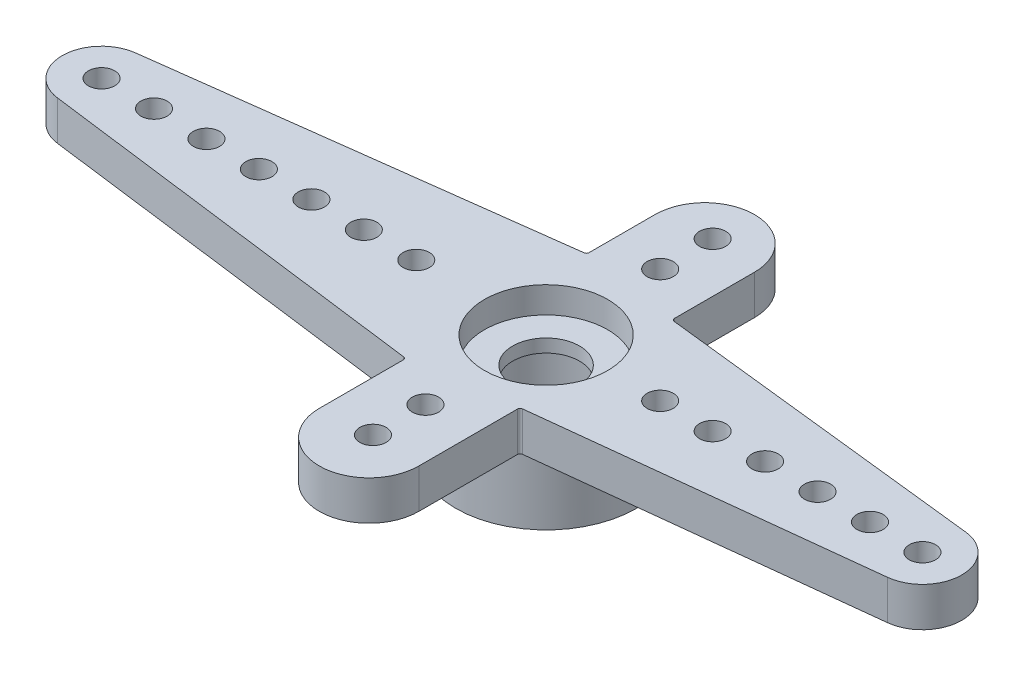
from build123d import *

# Parameters (mm, degrees)
IZIM1_R                     = 2.35
IZIM1_R_2                   = 0.5
Y_KSEKLIK_EKSTR_ZYON1_DEPTH = 1.5
IZIM1_3_R                   = 2.35
IZIM1_3_R_2                 = 1.275
Y_KSEKLIK_EKSTR_ZYON2_DEPTH = 0.5
IZIM2_R                     = 3.45
IZIM2_R_2                   = 2.3
Y_KSEKLIK_EKSTR_ZYON3_DEPTH = 2.5
RADYUS1_R                   = 0.1


with BuildPart() as part:
    # Çizim1 → Yükseklik-Ekstrüzyon1 (new body)
    with BuildSketch(Plane(origin=(0, 0, 0), x_dir=(1, 0, 0), z_dir=(0, 1, 0))):
        with BuildLine():
            Line((1.9, 2.9), (1.9, 6.05))
            ThreePointArc((1.9, 6.05), (0, 7.95), (-1.9, 6.05))
            Line((-1.9, 6.05), (-1.9, 3.45))
            Line((-1.9, 3.45), (-17.141537347, 1.487720889))
            ThreePointArc((-17.141537347, 1.487720889), (-18.45, 0), (-17.141537347, -1.487720889))
            Line((-17.141537347, -1.487720889), (-1.9, -3.45))
            Line((-1.9, -3.45), (-1.9, -6.75))
            ThreePointArc((-1.9, -6.75), (0, -8.65), (1.9, -6.75))
            Line((1.9, -6.75), (1.9, -2.9))
            Line((1.9, -2.9), (14.516515169, -1.490728915))
            ThreePointArc((14.516515169, -1.490728915), (15.85, 0), (14.516515169, 1.490728915))
            Line((14.516515169, 1.490728915), (1.9, 2.9))
        make_face()
        with Locations(Location((0, 0, 0), (0, 0, 270))):
            Circle(IZIM1_R, mode=Mode.SUBTRACT)
        with Locations(Location((-16.95, 0, 0), (0, 0, 270))):
            Circle(IZIM1_R_2, mode=Mode.SUBTRACT)
        with Locations(Location((-14.95, 0, 0), (0, 0, 270))):
            Circle(IZIM1_R_2, mode=Mode.SUBTRACT)
        with Locations(Location((-12.95, 0, 0), (0, 0, 270))):
            Circle(IZIM1_R_2, mode=Mode.SUBTRACT)
        with Locations(Location((-10.95, 0, 0), (0, 0, 270))):
            Circle(IZIM1_R_2, mode=Mode.SUBTRACT)
        with Locations(Location((-8.95, 0, 0), (0, 0, 270))):
            Circle(IZIM1_R_2, mode=Mode.SUBTRACT)
        with Locations(Location((-6.95, 0, 0), (0, 0, 270))):
            Circle(IZIM1_R_2, mode=Mode.SUBTRACT)
        with Locations(Location((-4.95, 0, 0), (0, 0, 270))):
            Circle(IZIM1_R_2, mode=Mode.SUBTRACT)
        with Locations(Location((14.35, 0, 0), (0, 0, 270))):
            Circle(IZIM1_R_2, mode=Mode.SUBTRACT)
        with Locations(Location((12.35, 0, 0), (0, 0, 270))):
            Circle(IZIM1_R_2, mode=Mode.SUBTRACT)
        with Locations(Location((10.35, 0, 0), (0, 0, 270))):
            Circle(IZIM1_R_2, mode=Mode.SUBTRACT)
        with Locations(Location((8.35, 0, 0), (0, 0, 270))):
            Circle(IZIM1_R_2, mode=Mode.SUBTRACT)
        with Locations(Location((6.35, 0, 0), (0, 0, 270))):
            Circle(IZIM1_R_2, mode=Mode.SUBTRACT)
        with Locations(Location((4.35, 0, 0), (0, 0, 270))):
            Circle(IZIM1_R_2, mode=Mode.SUBTRACT)
        with Locations(Location((0, 6.35, 0), (0, 0, 270))):
            Circle(IZIM1_R_2, mode=Mode.SUBTRACT)
        with Locations(Location((0, 4.35, 0), (0, 0, 270))):
            Circle(IZIM1_R_2, mode=Mode.SUBTRACT)
        with Locations(Location((0, -6.6, 0), (0, 0, 270))):
            Circle(IZIM1_R_2, mode=Mode.SUBTRACT)
        with Locations(Location((0, -4.6, 0), (0, 0, 270))):
            Circle(IZIM1_R_2, mode=Mode.SUBTRACT)
    extrude(amount=Y_KSEKLIK_EKSTR_ZYON1_DEPTH)

    # Çizim1<3> → Yükseklik-Ekstrüzyon2 (add)
    with BuildSketch(Plane(origin=(0, 0, 0), x_dir=(1, 0, 0), z_dir=(0, 1, 0))):
        with Locations(Location((0, 0, 0), (0, 0, 270))):
            Circle(IZIM1_3_R)
        with Locations(Location((0, 0, 0), (0, 0, 270))):
            Circle(IZIM1_3_R_2, mode=Mode.SUBTRACT)
    extrude(amount=Y_KSEKLIK_EKSTR_ZYON2_DEPTH)

    # Çizim2 → Yükseklik-Ekstrüzyon3 (add)
    with BuildSketch(Plane.XZ):
        with Locations(Location((0, 0, 0), (0, 0, 90))):
            Circle(IZIM2_R)
        with Locations(Location((0, 0, 0), (0, 0, 270))):
            Circle(IZIM2_R_2, mode=Mode.SUBTRACT)
    extrude(amount=Y_KSEKLIK_EKSTR_ZYON3_DEPTH)

    # Radyus1
    radyus1_edges = [part.edges().sort_by_distance(p)[0] for p in [
        (1.9, 0.75, -2.9),
        (1.9, 0.75, 2.9),
        (-1.9, 0.75, 3.45),
        (-1.9, 0.75, -3.45),
    ]]
    fillet(radyus1_edges, radius=RADYUS1_R)


solid = part.part
